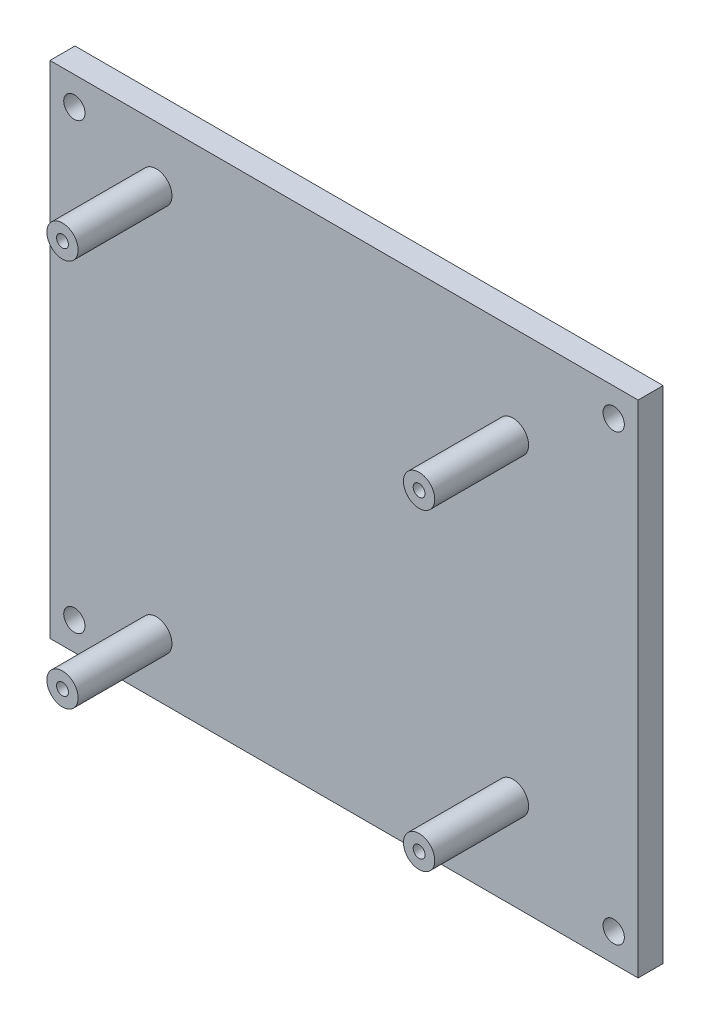
from build123d import *

# Parameters (mm, degrees)
SKETCH_1_W          = 94
SKETCH_1_H          = 80
EXTRUDE_1_DEPTH     = 4
CUT_EXTRUDE_1_REACH = 63.847
SKETCH_2_R          = 1.7
SKETCH_3_R          = 2.5
EXTRUDE_2_DEPTH     = 15
CUT_EXTRUDE_2_REACH = 66.576
SKETCH_4_R          = 0.95


with BuildPart() as part:
    # 草图1 → 凸台-拉伸1 (new body)
    with BuildSketch(Plane.XY):
        Rectangle(SKETCH_1_W, SKETCH_1_H)
    extrude(amount=EXTRUDE_1_DEPTH)

    # 草图2 → 切除-拉伸1 (cut, up to next)
    with BuildSketch(Plane.XY.offset(4), mode=Mode.PRIVATE) as cut_extrude_1_sk1:
        with Locations((-43.1, -35.5)):
            Circle(SKETCH_2_R)
    cut_extrude_1_tool1 = extrude(cut_extrude_1_sk1.sketch, amount=-CUT_EXTRUDE_1_REACH, mode=Mode.PRIVATE) & part.part
    # 草图2 → 切除-拉伸1 (cut, up to next)
    with BuildSketch(Plane.XY.offset(4), mode=Mode.PRIVATE) as cut_extrude_1_sk2:
        with Locations((43.1, -35.5)):
            Circle(SKETCH_2_R)
    cut_extrude_1_tool2 = extrude(cut_extrude_1_sk2.sketch, amount=-CUT_EXTRUDE_1_REACH, mode=Mode.PRIVATE) & part.part
    # 草图2 → 切除-拉伸1 (cut, up to next)
    with BuildSketch(Plane.XY.offset(4), mode=Mode.PRIVATE) as cut_extrude_1_sk3:
        with Locations((43.1, 35.5)):
            Circle(SKETCH_2_R)
    cut_extrude_1_tool3 = extrude(cut_extrude_1_sk3.sketch, amount=-CUT_EXTRUDE_1_REACH, mode=Mode.PRIVATE) & part.part
    # 草图2 → 切除-拉伸1 (cut, up to next)
    with BuildSketch(Plane.XY.offset(4), mode=Mode.PRIVATE) as cut_extrude_1_sk4:
        with Locations((-43.1, 35.5)):
            Circle(SKETCH_2_R)
    cut_extrude_1_tool4 = extrude(cut_extrude_1_sk4.sketch, amount=-CUT_EXTRUDE_1_REACH, mode=Mode.PRIVATE) & part.part
    add(cut_extrude_1_tool1.solids().sort_by_distance((-43.1, -35.5, 4))[0], mode=Mode.SUBTRACT)
    add(cut_extrude_1_tool2.solids().sort_by_distance((43.1, -35.5, 4))[0], mode=Mode.SUBTRACT)
    add(cut_extrude_1_tool3.solids().sort_by_distance((43.1, 35.5, 4))[0], mode=Mode.SUBTRACT)
    add(cut_extrude_1_tool4.solids().sort_by_distance((-43.1, 35.5, 4))[0], mode=Mode.SUBTRACT)

    # 草图3 → 凸台-拉伸2 (add)
    with BuildSketch(Plane.XY.offset(4)):
        with Locations((-30, 31)):
            Circle(SKETCH_3_R)
        with Locations((-30, -31)):
            Circle(SKETCH_3_R)
        with Locations((27, 25)):
            Circle(SKETCH_3_R)
        with Locations((27, -25)):
            Circle(SKETCH_3_R)
    extrude(amount=EXTRUDE_2_DEPTH)

    # 草图4 → 切除-拉伸2 (cut, up to next)
    with BuildSketch(Plane.XY.offset(19), mode=Mode.PRIVATE) as cut_extrude_2_sk1:
        with Locations((-30, 31)):
            Circle(SKETCH_4_R)
    cut_extrude_2_tool1 = extrude(cut_extrude_2_sk1.sketch, amount=-CUT_EXTRUDE_2_REACH, mode=Mode.PRIVATE) & part.part
    # 草图4 → 切除-拉伸2 (cut, up to next)
    with BuildSketch(Plane.XY.offset(19), mode=Mode.PRIVATE) as cut_extrude_2_sk2:
        with Locations((27, 25)):
            Circle(SKETCH_4_R)
    cut_extrude_2_tool2 = extrude(cut_extrude_2_sk2.sketch, amount=-CUT_EXTRUDE_2_REACH, mode=Mode.PRIVATE) & part.part
    # 草图4 → 切除-拉伸2 (cut, up to next)
    with BuildSketch(Plane.XY.offset(19), mode=Mode.PRIVATE) as cut_extrude_2_sk3:
        with Locations((-30, -31)):
            Circle(SKETCH_4_R)
    cut_extrude_2_tool3 = extrude(cut_extrude_2_sk3.sketch, amount=-CUT_EXTRUDE_2_REACH, mode=Mode.PRIVATE) & part.part
    # 草图4 → 切除-拉伸2 (cut, up to next)
    with BuildSketch(Plane.XY.offset(19), mode=Mode.PRIVATE) as cut_extrude_2_sk4:
        with Locations((27, -25)):
            Circle(SKETCH_4_R)
    cut_extrude_2_tool4 = extrude(cut_extrude_2_sk4.sketch, amount=-CUT_EXTRUDE_2_REACH, mode=Mode.PRIVATE) & part.part
    add(cut_extrude_2_tool1.solids().sort_by_distance((-30, 31, 19))[0], mode=Mode.SUBTRACT)
    add(cut_extrude_2_tool2.solids().sort_by_distance((27, 25, 19))[0], mode=Mode.SUBTRACT)
    add(cut_extrude_2_tool3.solids().sort_by_distance((-30, -31, 19))[0], mode=Mode.SUBTRACT)
    add(cut_extrude_2_tool4.solids().sort_by_distance((27, -25, 19))[0], mode=Mode.SUBTRACT)


solid = part.part
